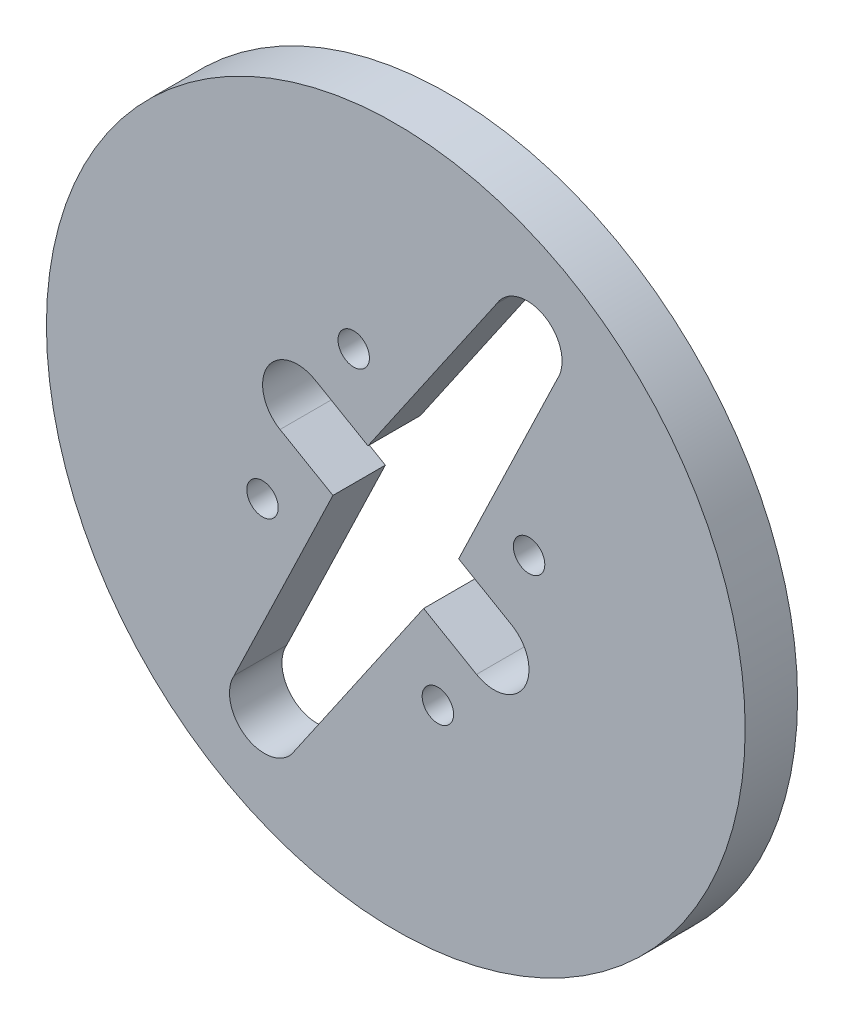
from build123d import *

# Parameters (mm, degrees)
SKETCH1_R           = 20
BOSS_EXTRUDE1_DEPTH = 3
SKETCH2_R           = 0.9
CUT_EXTRUDE1_DEPTH  = 3


with BuildPart() as part:
    # Sketch1 → Boss-Extrude1 (new body)
    with BuildSketch(Plane.XY):
        Circle(SKETCH1_R)
        with BuildLine():
            ThreePointArc((-6.627007241, 1.527342474), (-7.35518547, 4.260427995), (-4.622099949, 4.988606224))
            Line((-4.622099949, 4.988606224), (-1.593494167, 3.234312344))
            Line((-1.593494167, 3.234312344), (5.787770469, 13.982192711))
            ThreePointArc((5.787770469, 13.982192711), (8.037409208, 14.911223436), (9.518402344, 12.979739065))
            ThreePointArc((9.518402344, 12.979739065), (9.449886715, 12.460732201), (9.24903422, 11.977285419))
            Line((9.24903422, 11.977285419), (3.598401459, 0.226951406))
            Line((3.598401459, 0.226951406), (6.627007241, -1.527342474))
            ThreePointArc((6.627007241, -1.527342474), (7.35518547, -4.260427995), (4.622099949, -4.988606224))
            Line((4.622099949, -4.988606224), (1.593494167, -3.234312344))
            Line((1.593494167, -3.234312344), (-5.787770469, -13.982192711))
            ThreePointArc((-5.787770469, -13.982192711), (-8.52085599, -14.71037094), (-9.24903422, -11.977285419))
            Line((-9.24903422, -11.977285419), (-3.598401459, -0.226951406))
            Line((-3.598401459, -0.226951406), (-6.627007241, 1.527342474))
        make_face(mode=Mode.SUBTRACT)
    extrude(amount=BOSS_EXTRUDE1_DEPTH)

    # Sketch2 → Cut-Extrude1 (cut)
    with BuildSketch(Plane(origin=(0, 0, 0), x_dir=(-1, 0, 0), z_dir=(0, 0, -1))):
        with Locations((-2.408978249, -7.628684277)):
            Circle(SKETCH2_R)
        with Locations((-7.628684277, 2.408978249)):
            Circle(SKETCH2_R)
        with Locations((2.408978249, 7.628684277)):
            Circle(SKETCH2_R)
        with Locations((7.628684277, -2.408978249)):
            Circle(SKETCH2_R)
    extrude(amount=-CUT_EXTRUDE1_DEPTH, mode=Mode.SUBTRACT)


solid = part.part
